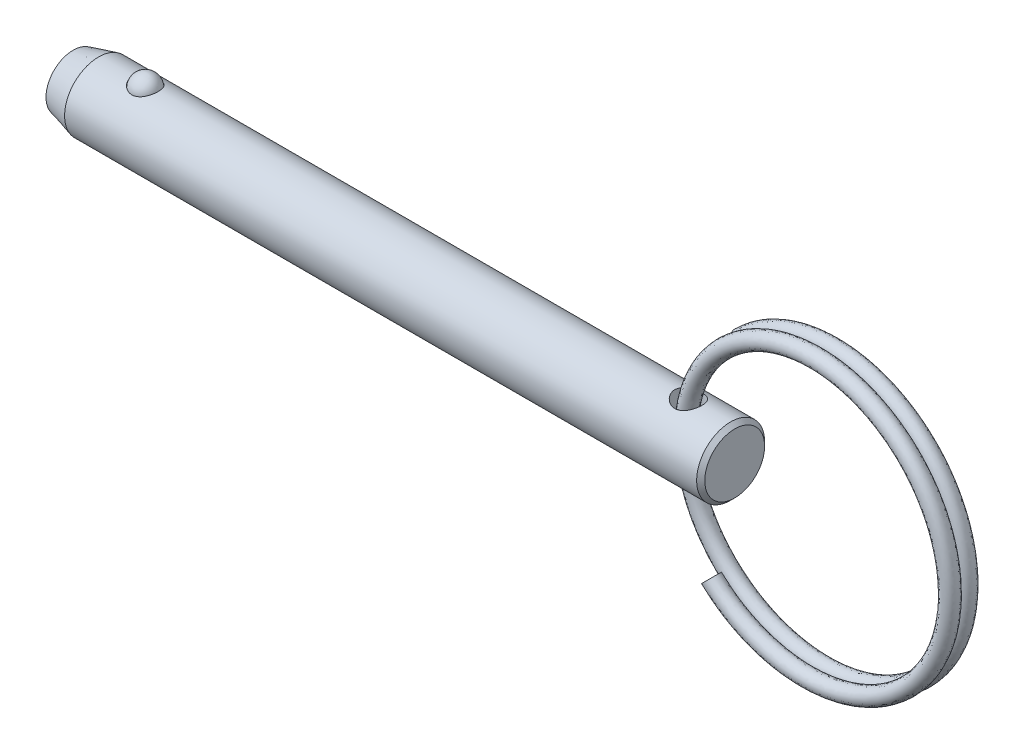
from build123d import *

# Parameters (mm, degrees)
SKETCH4_W          = 1.27
SKETCH4_H          = 6.35
SWEEP1_PITCH       = 1.5494
SWEEP1_HEIGHT      = 1.355725
SWEEP1_RADIUS      = 13.462
SKETCH6_R          = 0.762
SWEEP2_PITCH       = 1.5494
SWEEP2_HEIGHT      = 1.355725
SWEEP2_RADIUS      = 13.462
SWEEP2_START_ANGLE = -180
SKETCH6_2_R        = 0.762


with BuildPart() as part:
    # Sketch1 → Revolve1 (revolve)
    with BuildSketch(Plane.XY, mode=Mode.PRIVATE) as revolve1_sk:
        Polygon((30.8864, 2.794), (30.5054, 3.175), (-28.516547737, 3.175), (-30.8864, 2.54), (-30.8864, 0), (30.8864, 0), align=None)
    revolve(revolve1_sk.sketch.rotate(Axis((30.8864, 0, 0), (1, 0, 0)), 90), axis=Axis((30.8864, 0, 0), (1, 0, 0)))

    # Sketch2 → Cut-Revolve1 (revolve, cut)
    with BuildSketch(Plane.XY):
        with BuildLine():
            Line((-22.894582051, 2.8575), (-25.409182051, 2.8575))
            ThreePointArc((-25.409182051, 2.8575), (-24.151882051, 4.1148), (-22.894582051, 2.8575))
        make_face()
    revolve(axis=Axis((-22.894582051, 2.8575, 0), (1, 0, 0)), mode=Mode.SUBTRACT)

    # Sketch4 → Cut-Revolve2 (revolve, cut)
    with BuildSketch(Plane.XY, mode=Mode.PRIVATE) as cut_revolve2_sk:
        with Locations((27.2034, 0)):
            Rectangle(SKETCH4_W, SKETCH4_H)
    revolve(cut_revolve2_sk.sketch.rotate(Axis((26.5684, -3.175, 0), (0, 1, 0)), 90), axis=Axis((26.5684, -3.175, 0), (0, 1, 0)), mode=Mode.SUBTRACT)


with BuildPart() as body_2:
    # Sketch3 → Revolve2 (revolve)
    with BuildSketch(Plane.XY):
        with BuildLine():
            Line((-22.919982051, 2.8575), (-25.383782051, 2.8575))
            ThreePointArc((-25.383782051, 2.8575), (-24.151882051, 4.0894), (-22.919982051, 2.8575))
        make_face()
    revolve(axis=Axis((-22.919982051, 2.8575, 0), (1, 0, 0)))


with BuildPart() as body_3:
    # Sweep1: sweep along a helix
    with BuildLine() as sweep1_path:
        Helix(SWEEP1_PITCH, SWEEP1_HEIGHT, SWEEP1_RADIUS, center=(39.053425091, 0, 0), direction=(0, 0, -1), lefthand=True)
    # Sketch6 → Sweep1 (sweep)
    with BuildSketch(Plane(origin=(114.003847968, 0, 0), x_dir=(0, 0, -1), z_dir=(0, 1, 0))):
        with Locations((0, 87.650422877)):
            Circle(SKETCH6_R)
    sweep(path=sweep1_path.line, is_frenet=True)

    # Sweep2: sweep along a helix
    with BuildLine() as sweep2_path:
        add(Helix(SWEEP2_PITCH, SWEEP2_HEIGHT, SWEEP2_RADIUS, center=(39.053425091, 0, 0), direction=(0, 0, 1), lefthand=True, mode=Mode.PRIVATE).rotate(Axis((39.053425091, 0, 0), (0, 0, 1)), SWEEP2_START_ANGLE))
    # Sketch6<2> → Sweep2 (sweep)
    with BuildSketch(Plane(origin=(114.003847968, 0, 0), x_dir=(0, 0, -1), z_dir=(0, 1, 0))):
        with Locations((0, 87.650422877)):
            Circle(SKETCH6_2_R)
    sweep(path=sweep2_path.line, is_frenet=True)


solid = Compound([part.part, body_2.part, body_3.part])
